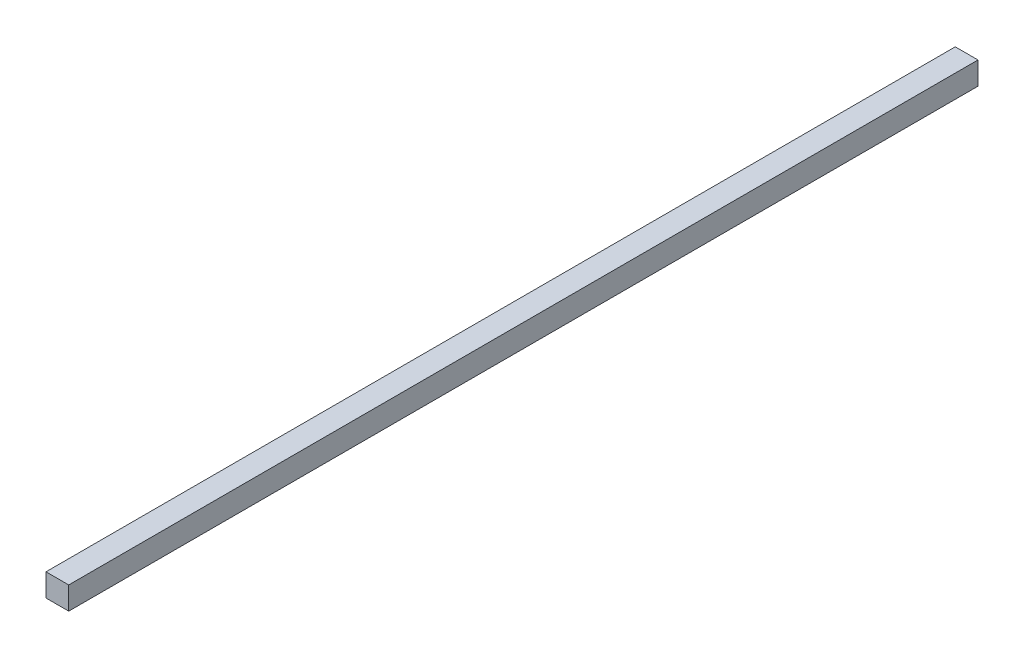
from build123d import *

# Parameters (mm, degrees)
SKETCH1_W      = 50.8
SKETCH1_H      = 50.8
EXTRUDE1_DEPTH = 2032


with BuildPart() as part:
    # Sketch1 → Extrude1 (new body)
    with BuildSketch(Plane.XY):
        with Locations((25.4, 25.4)):
            Rectangle(SKETCH1_W, SKETCH1_H)
    extrude(amount=EXTRUDE1_DEPTH)


solid = part.part
